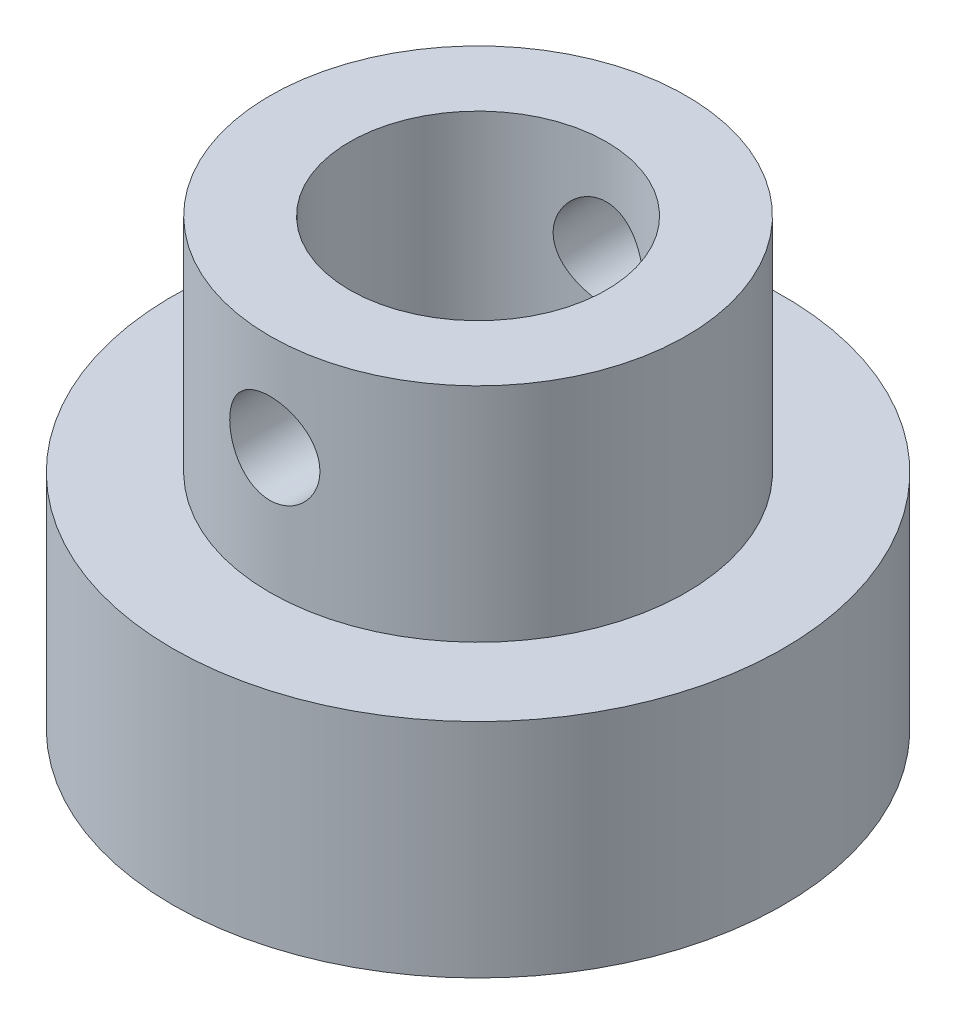
from build123d import *

# Parameters (mm, degrees)
SKETCH1_R           = 11
BOSS_EXTRUDE1_DEPTH = 8
SKETCH2_R           = 7.5
BOSS_EXTRUDE2_DEPTH = 8
SKETCH3_R           = 4.625
CUT_EXTRUDE1_DEPTH  = 8
CIRPATTERN1_COUNT   = 4
SKETCH10_W          = 1.625
SKETCH10_H          = 11


with BuildPart() as part:
    # Sketch1 → Boss-Extrude1 (new body)
    with BuildSketch(Plane(origin=(0, 0, 0), x_dir=(1, 0, 0), z_dir=(0, 1, 0))):
        with Locations(Location((0, 0, 0), (0, 0, 270))):
            Circle(SKETCH1_R)
    extrude(amount=BOSS_EXTRUDE1_DEPTH)

    # Sketch2 → Boss-Extrude2 (add)
    with BuildSketch(Plane(origin=(0, 8, 0), x_dir=(1, 0, 0), z_dir=(0, 1, 0))):
        with Locations(Location((0, 0, 0), (0, 0, 270))):
            Circle(SKETCH2_R)
    extrude(amount=BOSS_EXTRUDE2_DEPTH)

    # Sketch3 → Cut-Extrude1 (cut)
    with BuildSketch(Plane(origin=(0, 16, 0), x_dir=(1, 0, 0), z_dir=(0, 1, 0))):
        with Locations(Location((0, 0, 0), (0, 0, 270))):
            Circle(SKETCH3_R)
    extrude(amount=-CUT_EXTRUDE1_DEPTH, mode=Mode.SUBTRACT)

    # Sketch7 → Ø3.0mm Dowel Hole1 (revolve, cut)
    with BuildSketch(Plane(origin=(8, 0, 0), x_dir=(0, 0, -1), z_dir=(1, 0, 0))):
        Polygon((0, 0), (0, 6.901290929), (1.5, 6), (1.5, 0.482842712), (1.7, 0), align=None)
    f_3_0mm_dowel_hole1 = revolve(axis=Axis((8, -6.35, 0), (0, 1, 0)), mode=Mode.SUBTRACT)

    # CirPattern1: Ø3.0mm Dowel Hole1 ×4 about axis
    cirpattern1_axis = Axis((0, 0, 0), (0, 1, 0))
    for i in range(1, CIRPATTERN1_COUNT):
        add(f_3_0mm_dowel_hole1.rotate(cirpattern1_axis, i * 360 / CIRPATTERN1_COUNT), mode=Mode.SUBTRACT)

    # Sketch10 → Ø5.0mm Dowel Hole1 (revolve, cut)
    with BuildSketch(Plane(origin=(0, 12.5, 0), x_dir=(0, 1, 0), z_dir=(1, 0, 0))):
        with Locations((0.8125, 5.5)):
            Rectangle(SKETCH10_W, SKETCH10_H)
    f_5_0mm_dowel_hole1 = revolve(axis=Axis((0, 12.5, -6.35), (0, 0, 1)), mode=Mode.SUBTRACT)

    # Mirror1: Ø5.0mm Dowel Hole1 across plane
    add(f_5_0mm_dowel_hole1.mirror(Plane.XY), mode=Mode.SUBTRACT)


solid = part.part
